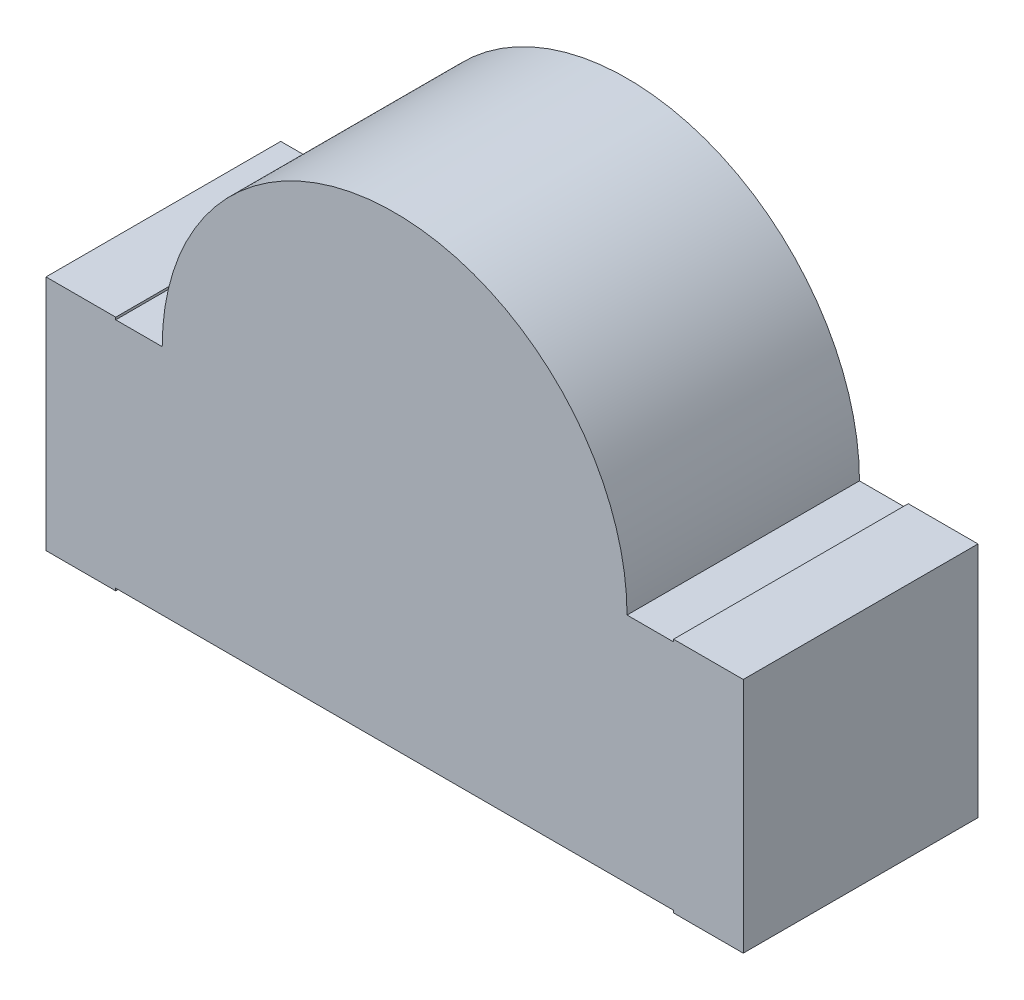
from build123d import *

# Parameters (mm, degrees)
EXTRUDE_1_DEPTH = 1
SKETCH_3_W      = 1.01
SKETCH_3_H      = 1.02
EXTRUDE_2_DEPTH = 0.3
EXTRUDE_3_DEPTH = 0.3


with BuildPart() as part:
    # 草图1 → 凸台-拉伸1 (new body)
    with BuildSketch(Plane.XY):
        with BuildLine():
            Line((2.5, 1), (3, 1))
            Line((3, 1), (3, 0))
            Line((3, 0), (0, 0))
            Line((0, 0), (0, 1))
            Line((0, 1), (0.5, 1))
            ThreePointArc((0.5, 1), (1.5, 2), (2.5, 1))
        make_face()
    extrude(amount=EXTRUDE_1_DEPTH)

    # 草图3 → 凸台-拉伸2 (add)
    with BuildSketch(Plane(origin=(3, 0, 0), x_dir=(0, 0, -1), z_dir=(1, 0, 0))):
        with Locations((-0.495, 0.5)):
            Rectangle(SKETCH_3_W, SKETCH_3_H)
    extrude(amount=-EXTRUDE_2_DEPTH)

    # 草图4 → 凸台-拉伸3 (add)
    with BuildSketch(Plane.ZY):
        Polygon((-0.01, -0.01), (-0.01, 1.01), (1, 1.01), (1, 0), (1, -0.01), align=None)
    extrude(amount=-EXTRUDE_3_DEPTH)


solid = part.part
